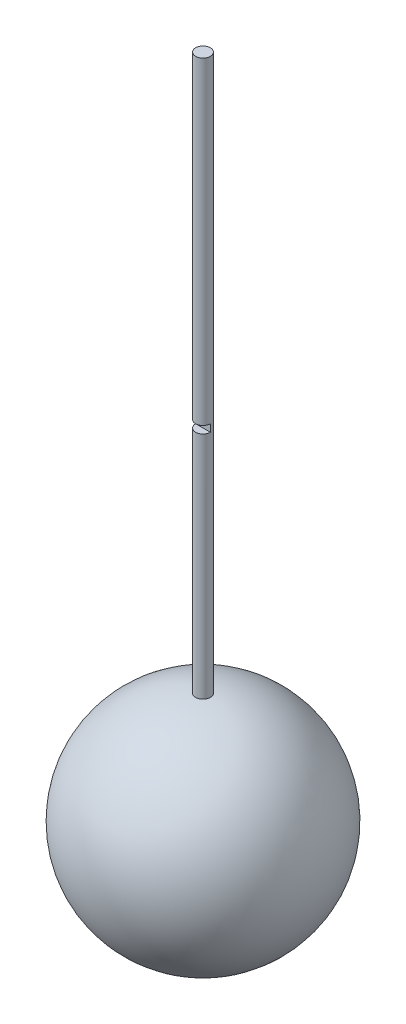
from build123d import *

# Parameters (mm, degrees)
CROQUIS3_R                 = 1
SALIENTE_EXTRUIR1_DEPTH    = 90
CORTAR_EXTRUIR1_DEPTH      = 10
CORTAR_EXTRUIR1_DEPTH_BACK = 10
CROQUIS4_W                 = 4.139739446
CROQUIS4_H                 = 1


with BuildPart() as part:
    # Croquis2 → Revolución1 (revolve)
    with BuildSketch(Plane.XY):
        with BuildLine():
            Line((0, 15), (0, 13.292119178))
            ThreePointArc((0, 13.292119178), (-13.292119178, 0), (0, -13.292119178))
            Line((0, -13.292119178), (0, -15))
            ThreePointArc((0, -15), (-15, 0), (0, 15))
        make_face()
    revolve(axis=Axis((0, 15, 0), (0, -1, 0)))

    # Croquis3 → Saliente-Extruir1 (add)
    with BuildSketch(Plane(origin=(0, 0, 0), x_dir=(1, 0, 0), z_dir=(0, 1, 0))):
        Circle(CROQUIS3_R)
    extrude(amount=SALIENTE_EXTRUIR1_DEPTH)

    # Croquis4 → Cortar-Extruir1 (cut, two sides: drawn at the far end of the back side and taken through both)
    with BuildSketch(Plane(origin=(0, 0, 0), x_dir=(0, 0, -1), z_dir=(1, 0, 0)).offset(-CORTAR_EXTRUIR1_DEPTH_BACK)):
        with Locations((-2.069869723, 46.5)):
            Rectangle(CROQUIS4_W, CROQUIS4_H)
    extrude(amount=CORTAR_EXTRUIR1_DEPTH + CORTAR_EXTRUIR1_DEPTH_BACK, mode=Mode.SUBTRACT)


solid = part.part
